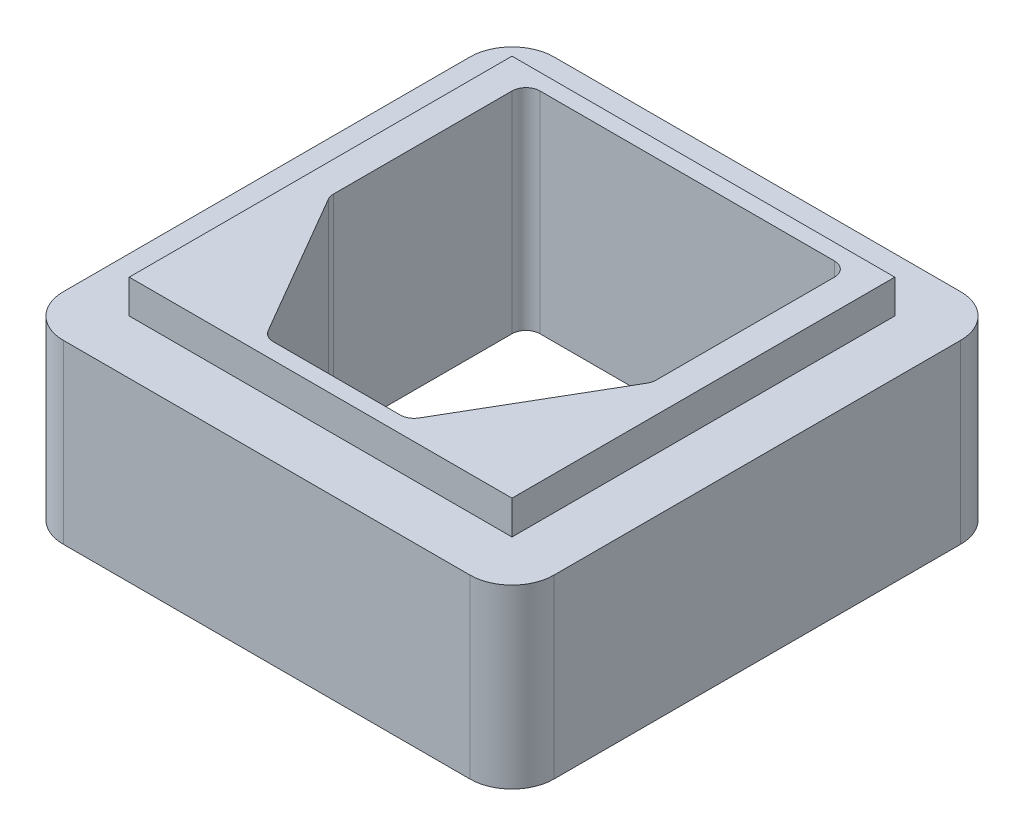
from build123d import *

# Parameters (mm, degrees)
SKETCH1_W           = 27.3
SKETCH1_H           = 27.3
BOSS_EXTRUDE1_DEPTH = 15
SKETCH3_W           = 35
SKETCH3_H           = 35
SKETCH3_W_2         = 27.3
SKETCH3_H_2         = 27.3
BOSS_EXTRUDE2_DEPTH = 12.6
FILLET1_R           = 1
FILLET3_R           = 3


with BuildPart() as part:
    # Sketch1 → Boss-Extrude1 (new body)
    with BuildSketch(Plane(origin=(0, 0, 0), x_dir=(1, 0, 0), z_dir=(0, 1, 0))):
        with Locations((11.5, -12.5)):
            Rectangle(SKETCH1_W, SKETCH1_H)
        Polygon((0, 0), (23, 0), (23, -14), (16.6, -25), (6.4, -25), (0, -14), align=None, mode=Mode.SUBTRACT)
    extrude(amount=BOSS_EXTRUDE1_DEPTH)

    # Sketch3 → Boss-Extrude2 (add)
    with BuildSketch(Plane(origin=(0, 0, 0), x_dir=(1, 0, 0), z_dir=(0, 1, 0))):
        with Locations((11.5, -12.5)):
            Rectangle(SKETCH3_W, SKETCH3_H)
        with Locations((11.5, -12.5)):
            Rectangle(SKETCH3_W_2, SKETCH3_H_2, mode=Mode.SUBTRACT)
    extrude(amount=BOSS_EXTRUDE2_DEPTH)

    # Fillet1
    fillet1_edges = [part.edges().sort_by_distance(p)[0] for p in [
        (16.6, 7.5, 25),
        (6.4, 7.5, 25),
        (23, 7.5, 0),
        (0, 7.5, 0),
        (23, 7.5, 14),
        (0, 7.5, 14),
    ]]
    fillet(fillet1_edges, radius=FILLET1_R)

    # Fillet3
    fillet3_edges = [part.edges().sort_by_distance(p)[0] for p in [
        (29, 6.3, -5),
        (-6, 6.3, -5),
        (-6, 6.3, 30),
        (29, 6.3, 30),
    ]]
    fillet(fillet3_edges, radius=FILLET3_R)


solid = part.part
